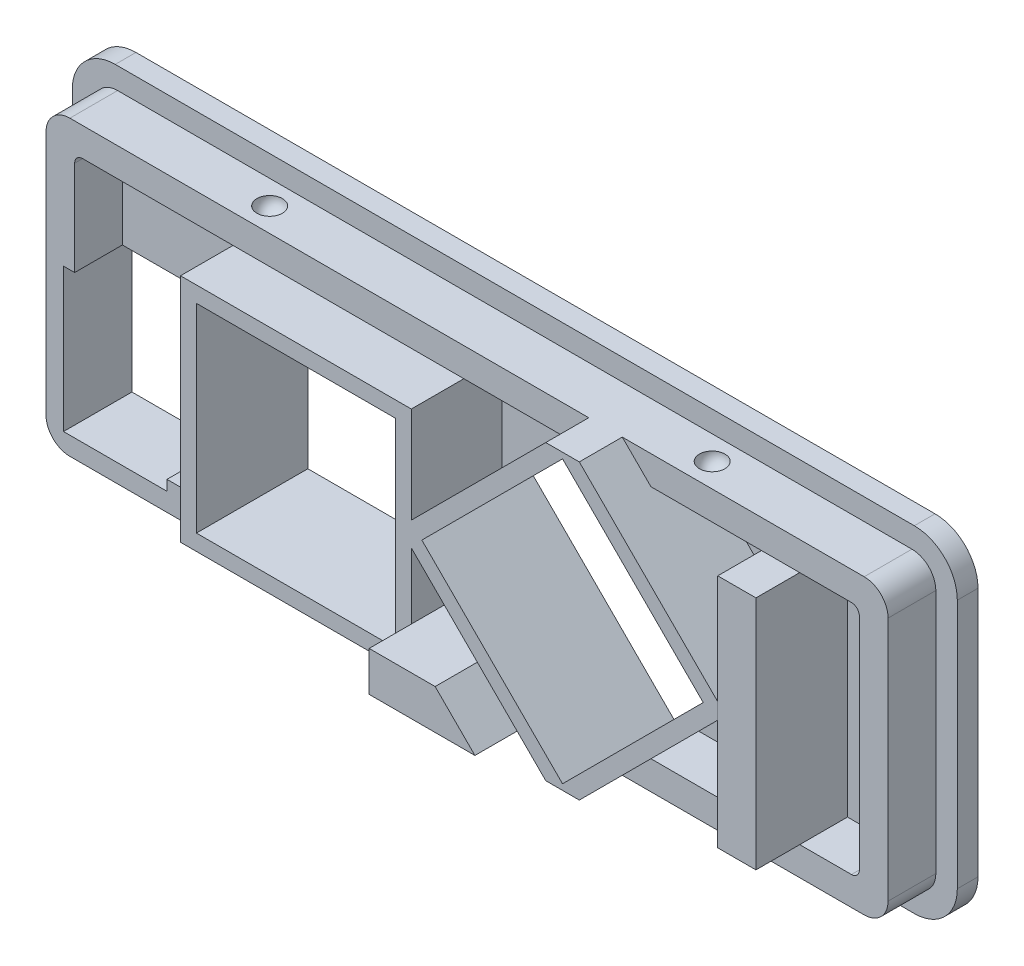
from build123d import *

# Parameters (mm, degrees)
BOSS_EXTRUDE1_DEPTH = 1.3
BOSS_EXTRUDE3_DEPTH = 3
CUT_EXTRUDE1_DEPTH  = 3
SKETCH11_W          = 6.5
SKETCH11_H          = 9
CUT_EXTRUDE2_DEPTH  = 4.3
SKETCH12_W          = 12.5
SKETCH12_H          = 12.5
CUT_EXTRUDE4_DEPTH  = 1.3
SKETCH17_W          = 14.5
SKETCH17_H          = 14.5
SKETCH17_W_2        = 12.5
SKETCH17_H_2        = 12.5
BOSS_EXTRUDE4_DEPTH = 7
CUT_EXTRUDE5_DEPTH  = 4.3
BOSS_EXTRUDE5_DEPTH = 7
CUT_EXTRUDE6_START  = -3
CUT_EXTRUDE6_DEPTH  = 23
SKETCH21_W          = 2.5
SKETCH21_H          = 2.5
CUT_EXTRUDE7_DEPTH  = 10
SKETCH23_W          = 2.4
SKETCH23_H          = 14.8
BOSS_EXTRUDE6_DEPTH = 5.75
BOSS_EXTRUDE7_DEPTH = 8.35


with BuildPart() as part:
    # Sketch1 → Boss-Extrude1 (new body)
    with BuildSketch(Plane.XY):
        with BuildLine():
            Line((2.7, 0), (52.9, 0))
            ThreePointArc((52.9, 0), (54.809188309, 0.790811691), (55.6, 2.7))
            Line((55.6, 2.7), (55.6, 18.4))
            ThreePointArc((55.6, 18.4), (54.809188309, 20.309188309), (52.9, 21.1))
            Line((52.9, 21.1), (2.7, 21.1))
            ThreePointArc((2.7, 21.1), (0.790811691, 20.309188309), (0, 18.4))
            Line((0, 18.4), (0, 2.7))
            ThreePointArc((0, 2.7), (0.790811691, 0.790811691), (2.7, 0))
        make_face()
    extrude(amount=BOSS_EXTRUDE1_DEPTH)

    # Sketch4 → Boss-Extrude3 (add)
    with BuildSketch(Plane.XY.offset(1.3)):
        with BuildLine():
            Line((54.25, 2.85), (54.25, 18.25))
            ThreePointArc((54.25, 18.25), (53.810660172, 19.310660172), (52.75, 19.75))
            Line((52.75, 19.75), (2.85, 19.75))
            ThreePointArc((2.85, 19.75), (1.789339828, 19.310660172), (1.35, 18.25))
            Line((1.35, 18.25), (1.35, 2.85))
            ThreePointArc((1.35, 2.85), (1.789339828, 1.789339828), (2.85, 1.35))
            Line((2.85, 1.35), (52.75, 1.35))
            ThreePointArc((52.75, 1.35), (53.810660172, 1.789339828), (54.25, 2.85))
        make_face()
    extrude(amount=BOSS_EXTRUDE3_DEPTH)

    # Sketch5 → Cut-Extrude1 (cut)
    with BuildSketch(Plane.XY.offset(4.3)):
        with BuildLine():
            Line((51.95, 17.95), (3.65, 17.95))
            ThreePointArc((3.65, 17.95), (3.296446609, 17.803553391), (3.15, 17.45))
            Line((3.15, 17.45), (3.15, 3.65))
            ThreePointArc((3.15, 3.65), (3.296446609, 3.296446609), (3.65, 3.15))
            Line((3.65, 3.15), (51.95, 3.15))
            ThreePointArc((51.95, 3.15), (52.303553391, 3.296446609), (52.45, 3.65))
            Line((52.45, 3.65), (52.45, 17.45))
            ThreePointArc((52.45, 17.45), (52.303553391, 17.803553391), (51.95, 17.95))
        make_face()
    extrude(amount=-CUT_EXTRUDE1_DEPTH, mode=Mode.SUBTRACT)

    # Sketch10 → Cut-Revolve1 (revolve, cut)
    with BuildSketch(Plane(origin=(0, 19.75, 0), x_dir=(1, 0, 0), z_dir=(0, 1, 0))):
        with BuildLine():
            Line((41.7, -2), (41.7, -3.6))
            ThreePointArc((41.7, -3.6), (40.9, -2.8), (41.7, -2))
        make_face()
    cut_revolve1 = revolve(axis=Axis((41.7, 19.75, 2), (0, 0, 1)), mode=Mode.SUBTRACT)

    # Mirror1: Cut-Revolve1 across plane
    add(cut_revolve1.mirror(Plane(origin=(0, 10.55, 0), x_dir=(0, 0, 1), z_dir=(0, -1, 0))), mode=Mode.SUBTRACT)

    # Sketch11 → Cut-Extrude2 (cut)
    with BuildSketch(Plane(origin=(0, 0, 0), x_dir=(-1, 0, 0), z_dir=(0, 0, -1))):
        with Locations((-5.7, 7)):
            Rectangle(SKETCH11_W, SKETCH11_H)
    extrude(amount=-CUT_EXTRUDE2_DEPTH, mode=Mode.SUBTRACT)

    # Sketch12 → Cut-Extrude4 (cut)
    with BuildSketch(Plane(origin=(0, 0, 0), x_dir=(-1, 0, 0), z_dir=(0, 0, -1))):
        with Locations((-19.75, 10.1)):
            Rectangle(SKETCH12_W, SKETCH12_H)
    extrude(amount=-CUT_EXTRUDE4_DEPTH, mode=Mode.SUBTRACT)

    # Sketch17 → Boss-Extrude4 (add)
    with BuildSketch(Plane(origin=(0, 0, 0), x_dir=(-1, 0, 0), z_dir=(0, 0, -1))):
        with Locations((-19.75, 10.1)):
            Rectangle(SKETCH17_W, SKETCH17_H)
        with Locations((-19.75, 10.1)):
            Rectangle(SKETCH17_W_2, SKETCH17_H_2, mode=Mode.SUBTRACT)
    extrude(amount=-BOSS_EXTRUDE4_DEPTH)

    # Sketch13 → Cut-Extrude5 (cut)
    with BuildSketch(Plane(origin=(0, 0, 0), x_dir=(-1, 0, 0), z_dir=(0, 0, -1))):
        Polygon((-45.338834765, 10.55), (-36.5, 1.711165235), (-27.661165235, 10.55), (-36.5, 19.388834765), align=None)
    extrude(amount=-CUT_EXTRUDE5_DEPTH, mode=Mode.SUBTRACT)

    # Sketch18 → Boss-Extrude5 (add)
    with BuildSketch(Plane(origin=(0, 0, 0), x_dir=(-1, 0, 0), z_dir=(0, 0, -1))):
        Polygon((-46.753048327, 10.55), (-36.5, 0.296951673), (-26.246951673, 10.55), (-36.5, 20.803048327), align=None)
        Polygon((-36.5, 19.388834765), (-45.338834765, 10.55), (-36.5, 1.711165235), (-27.661165235, 10.55), align=None, mode=Mode.SUBTRACT)
    extrude(amount=-BOSS_EXTRUDE5_DEPTH)

    # Sketch20 → Cut-Extrude6 (cut)
    with BuildSketch(Plane.XY.offset(4.3).offset(CUT_EXTRUDE6_START)):
        Polygon((35.446951673, 19.75), (37.553048327, 19.75), (36.5, 20.803048327), align=None)
    cut_extrude6 = extrude(amount=CUT_EXTRUDE6_DEPTH, mode=Mode.SUBTRACT)

    # Mirror2: Cut-Extrude6 across plane
    add(cut_extrude6.mirror(Plane(origin=(0, 10.55, 0), x_dir=(0, 0, 1), z_dir=(0, -1, 0))), mode=Mode.SUBTRACT)

    # Sketch21 → Cut-Extrude7 (cut)
    with BuildSketch(Plane(origin=(0, 0, 0), x_dir=(-1, 0, 0), z_dir=(0, 0, -1))):
        with Locations((-29, 16.6)):
            Rectangle(SKETCH21_W, SKETCH21_H)
    extrude(amount=-CUT_EXTRUDE7_DEPTH, mode=Mode.SUBTRACT)

    # Mirror3: Cut-Revolve1 across plane
    add(cut_revolve1.mirror(Plane.ZY.offset(-27.8)), mode=Mode.SUBTRACT)

    # Mirror3 copy 1 sketch → Mirror3 copy 1 (revolve, cut)
    with BuildSketch(Plane(origin=(55.6, 1.35, 0), x_dir=(-1, 0, 0), z_dir=(0, -1, 0))):
        with BuildLine():
            Line((41.7, -2), (41.7, -3.6))
            ThreePointArc((41.7, -3.6), (40.9, -2.8), (41.7, -2))
        make_face()
    revolve(axis=Axis((13.9, 1.35, 2), (0, 0, 1)), mode=Mode.SUBTRACT)

    # Sketch23 → Boss-Extrude6 (add)
    with BuildSketch(Plane.XY.offset(1.3)):
        with Locations((47.5, 10.55)):
            Rectangle(SKETCH23_W, SKETCH23_H)
    extrude(amount=BOSS_EXTRUDE6_DEPTH)

    # Sketch24 → Boss-Extrude7 (add)
    with BuildSketch(Plane.XY.offset(1.3)):
        Polygon((33.646951673, 3.15), (27, 3.15), (27, 5.65), (31.146951673, 5.65), align=None)
    extrude(amount=BOSS_EXTRUDE7_DEPTH)


solid = part.part
